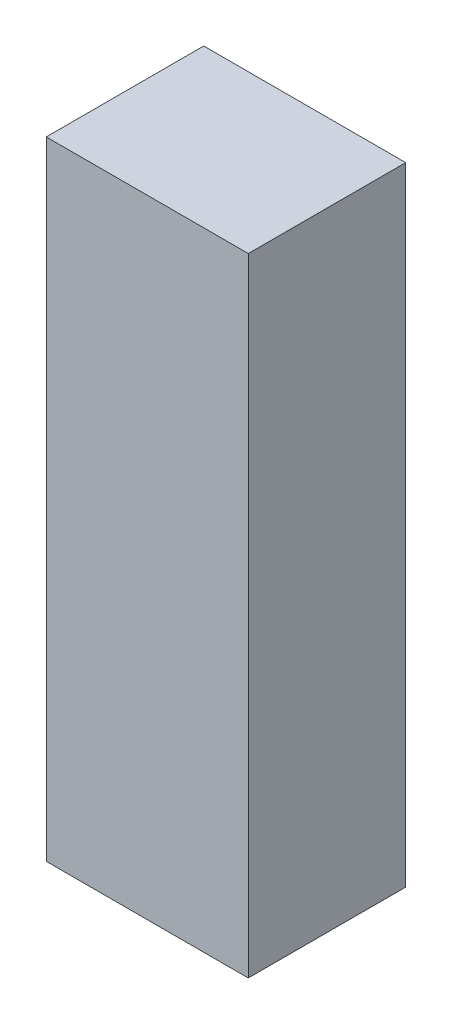
from build123d import *

# Parameters (mm, degrees)
ESBO_O1_W                = 34
ESBO_O1_H                = 105.6
RESSALTO_EXTRUS_O1_DEPTH = 26.5


with BuildPart() as part:
    # Esboço1 → Ressalto-extrusão1 (new body)
    with BuildSketch(Plane.XY):
        Rectangle(ESBO_O1_W, ESBO_O1_H)
    extrude(amount=RESSALTO_EXTRUS_O1_DEPTH)


solid = part.part
